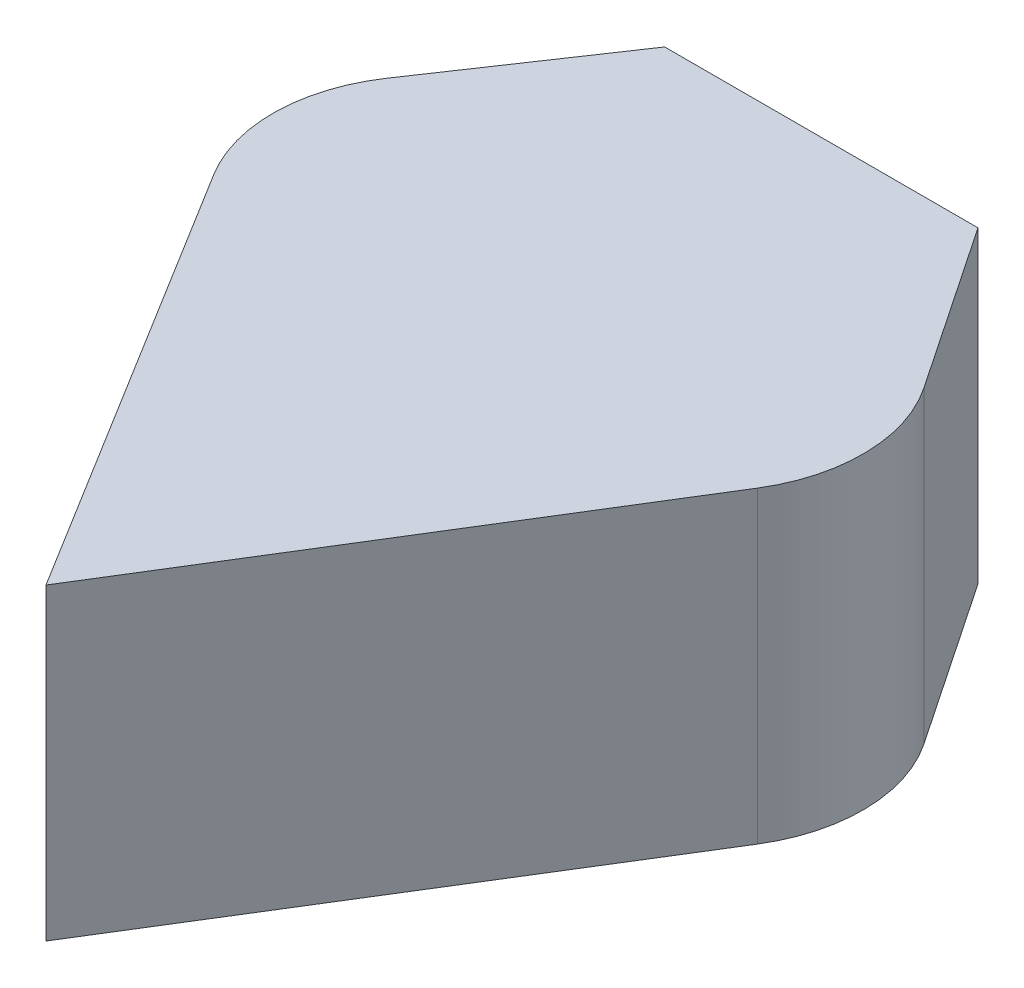
from build123d import *

# Parameters (mm, degrees)
BOSS_EXTRUDE1_DEPTH = 0.0125


with BuildPart() as part:
    # Sketch1 → Boss-Extrude1 (new, symmetric)
    with BuildSketch(Plane(origin=(0, 0, 0), x_dir=(1, 0, 0), z_dir=(0, 1, 0))):
        with BuildLine():
            Line((1.347978039, -1.312633824), (1.37338193, -1.312633824))
            Line((1.37338193, -1.312633824), (1.382439971, -1.326079965))
            ThreePointArc((1.382439971, -1.326079965), (1.384605674, -1.332930173), (1.38270998, -1.339859962))
            Line((1.38270998, -1.339859962), (1.360679984, -1.375499964))
            Line((1.360679984, -1.375499964), (1.338649988, -1.339859962))
            ThreePointArc((1.338649988, -1.339859962), (1.336754294, -1.332930173), (1.338919997, -1.326079965))
            Line((1.338919997, -1.326079965), (1.347978039, -1.312633824))
        make_face()
    extrude(amount=BOSS_EXTRUDE1_DEPTH, both=True)


solid = part.part
